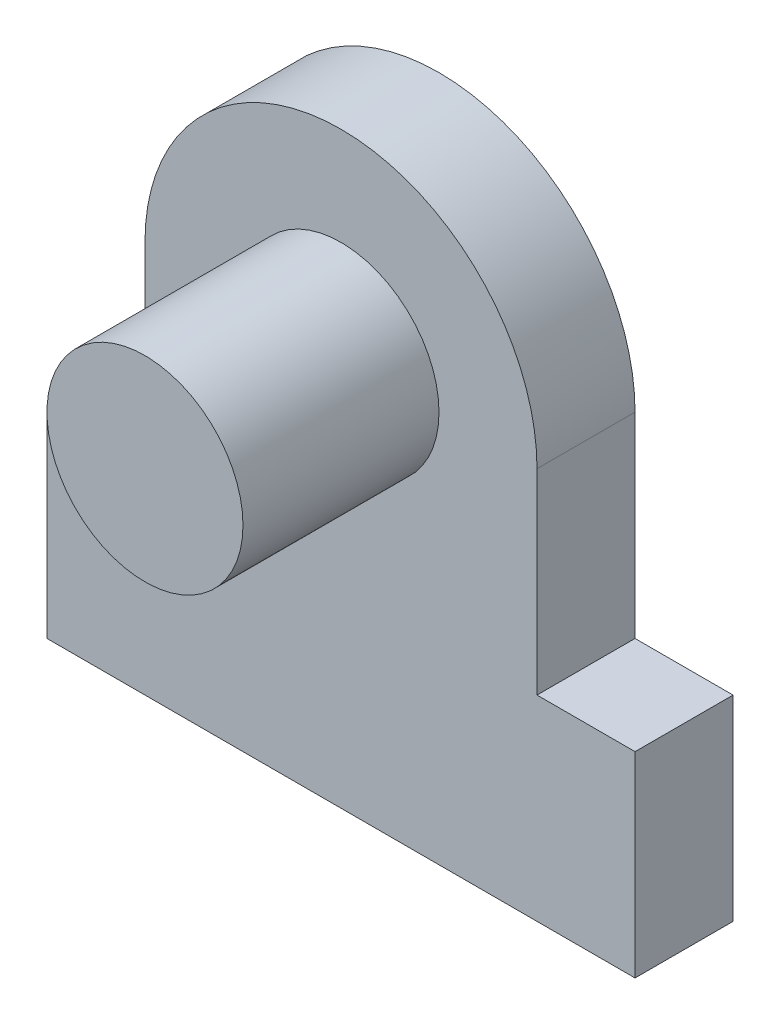
from build123d import *

# Parameters (mm, degrees)
BOSS_EXTRU_1_DEPTH = 10
ESQUISSE2_R        = 10
BOSS_EXTRU_2_DEPTH = 20


with BuildPart() as part:
    # Esquisse1 → Boss.-Extru.1 (new body)
    with BuildSketch(Plane.XY):
        with BuildLine():
            Line((-30, 0), (30, 0))
            Line((30, 0), (30, 20))
            Line((30, 20), (20, 20))
            Line((20, 20), (20, 40))
            ThreePointArc((20, 40), (0, 60), (-20, 40))
            Line((-20, 40), (-20, 20))
            Line((-20, 20), (-30, 20))
            Line((-30, 20), (-30, 0))
        make_face()
    extrude(amount=BOSS_EXTRU_1_DEPTH)

    # Esquisse2 → Boss.-Extru.2 (add)
    with BuildSketch(Plane.XY.offset(10)):
        with Locations((0, 40)):
            Circle(ESQUISSE2_R)
    extrude(amount=BOSS_EXTRU_2_DEPTH)


solid = part.part
